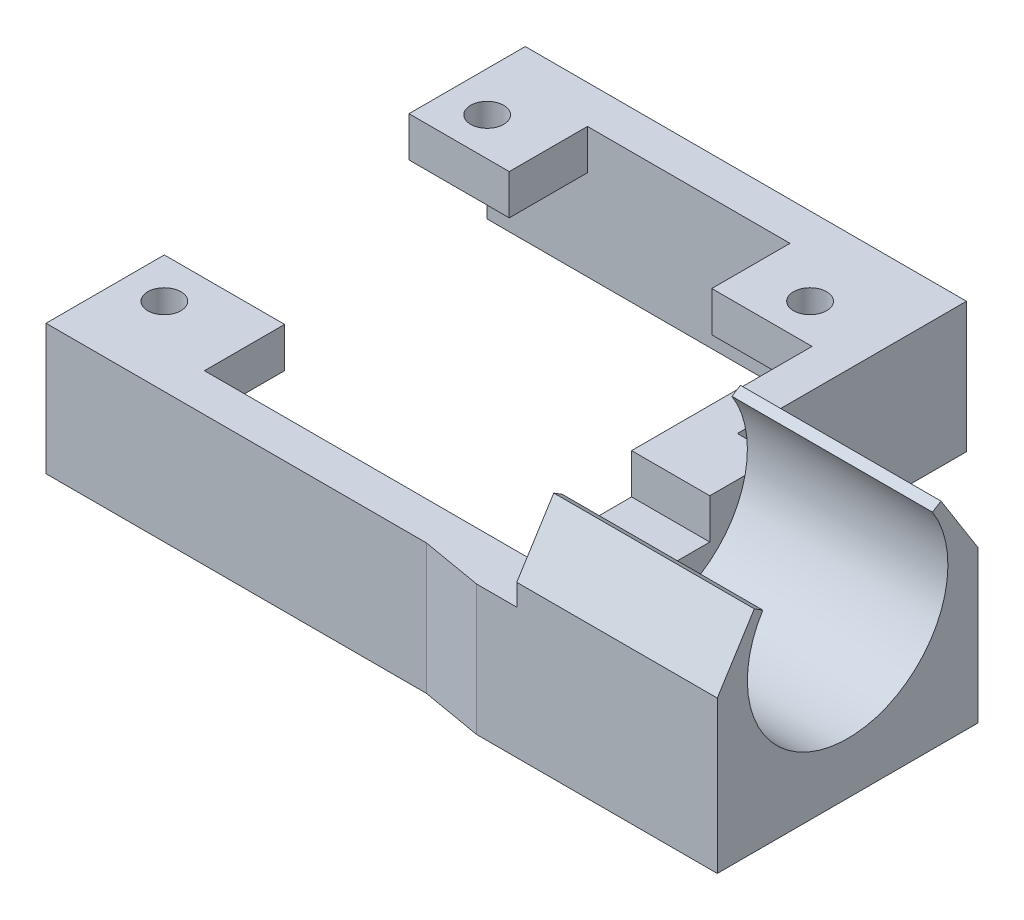
from build123d import *

# Parameters (mm, degrees)
BOSS_EXTRUDE1_DEPTH = 9
SKETCH11_W          = 26
SKETCH11_H          = 9
BOSS_EXTRUDE2_DEPTH = 4
BOSS_EXTRUDE3_START = 4
BOSS_EXTRUDE3_DEPTH = 20
BOSS_EXTRUDE4_DEPTH = 9
SKETCH13_W          = 12
SKETCH13_H          = 8
SKETCH13_R          = 1.65
SKETCH13_H_2        = 3.8
SKETCH13_W_2        = 20.2
SKETCH13_W_3        = 4
SKETCH13_H_3        = 6.75
BOSS_EXTRUDE5_DEPTH = 4


with BuildPart() as part:
    # Sketch1 → Boss-Extrude1 (new body)
    with BuildSketch(Plane(origin=(0, 0, 0), x_dir=(1, 0, 0), z_dir=(0, 1, 0))):
        Polygon((-20.1, 20.1), (20.1, 20.1), (20.1, -20.1), (-20.1, -20.1), (-20.1, -23.9), (23.9, -23.9), (23.9, 23.9), (-20.1, 23.9), align=None)
    extrude(amount=BOSS_EXTRUDE1_DEPTH)

    # Sketch11 → Boss-Extrude2 (add)
    with BuildSketch(Plane(origin=(23.9, 0, 0), x_dir=(0, 0, -1), z_dir=(1, 0, 0))):
        with Locations((-11.95, 4.5)):
            Rectangle(SKETCH11_W, SKETCH11_H)
    extrude(amount=BOSS_EXTRUDE2_DEPTH)

    # Sketch10 → Boss-Extrude3 (add)
    with BuildSketch(Plane(origin=(23.9, 0, 0), x_dir=(0, 0, -1), z_dir=(1, 0, 0)).offset(BOSS_EXTRUDE3_START)):
        with BuildLine():
            Line((-21.257692308, 21.01232581), (-24.95, 15.15))
            Line((-24.95, 15.15), (-24.95, 0))
            Line((-24.95, 0), (1.05, 0))
            Line((1.05, 0), (1.05, 15.15))
            Line((1.05, 15.15), (-2.642307692, 21.01232581))
            Line((-2.642307692, 21.01232581), (-3.488461538, 20.4793871))
            ThreePointArc((-3.488461538, 20.4793871), (-11.95, 5.15), (-20.411538462, 20.4793871))
            Line((-20.411538462, 20.4793871), (-21.257692308, 21.01232581))
        make_face()
    extrude(amount=BOSS_EXTRUDE3_DEPTH)

    # Sketch12 → Boss-Extrude4 (add)
    with BuildSketch(Plane(origin=(0, 9, 0), x_dir=(1, 0, 0), z_dir=(0, 1, 0))):
        Polygon((23.9, -24.95), (17.829406445, -23.9), (23.9, -23.9), align=None)
    extrude(amount=-BOSS_EXTRUDE4_DEPTH)

    # Sketch13 → Boss-Extrude5 (add)
    # profile 1 of 9: a face of its own
    with BuildSketch(Plane(origin=(0, 9, 0), x_dir=(1, 0, 0), z_dir=(0, 1, 0))):
        with Locations((-14.1, -16.1)):
            Rectangle(SKETCH13_W, SKETCH13_H)
        with Locations(Location((-16.1, -16.1, 0), (0, 0, 270))):
            Circle(SKETCH13_R, mode=Mode.SUBTRACT)
    # profile 2 of 9: a face of its own
    with BuildSketch(Plane(origin=(0, 9, 0), x_dir=(1, 0, 0), z_dir=(0, 1, 0))):
        with Locations((-14.1, -22)):
            Rectangle(SKETCH13_W, SKETCH13_H_2)
    # profile 3 of 9: a face of its own
    with BuildSketch(Plane(origin=(0, 9, 0), x_dir=(1, 0, 0), z_dir=(0, 1, 0))):
        Polygon((27.9, -20.1), (-8.1, -20.1), (-8.1, -23.9), (17.829406445, -23.9), (27.9, -23.9), align=None)
    # profile 4 of 9: a face of its own
    with BuildSketch(Plane(origin=(0, 9, 0), x_dir=(1, 0, 0), z_dir=(0, 1, 0))):
        Polygon((27.9, -23.9), (17.829406445, -23.9), (23.9, -24.95), (27.9, -24.95), align=None)
    # profile 5 of 9: a face of its own
    with BuildSketch(Plane(origin=(0, 9, 0), x_dir=(1, 0, 0), z_dir=(0, 1, 0))):
        Polygon((23.9, 12.3), (23.9, 23.9), (10.1, 23.9), (10.1, 20.1), (10.1, 12.3), (20.1, 12.3), align=None)
        with Locations(Location((16.1, 16.1, 0), (0, 0, 270))):
            Circle(SKETCH13_R, mode=Mode.SUBTRACT)
    # profile 6 of 9: a face of its own
    with BuildSketch(Plane(origin=(0, 9, 0), x_dir=(1, 0, 0), z_dir=(0, 1, 0))):
        with Locations((0, 22)):
            Rectangle(SKETCH13_W_2, SKETCH13_H_2)
    # profile 7 of 9: a face of its own
    with BuildSketch(Plane(origin=(0, 9, 0), x_dir=(1, 0, 0), z_dir=(0, 1, 0))):
        Polygon((23.9, 1.05), (23.9, 12.3), (20.1, 12.3), (20.1, -5.7), (23.9, -5.7), align=None)
    # profile 8 of 9: a face of its own
    with BuildSketch(Plane(origin=(0, 9, 0), x_dir=(1, 0, 0), z_dir=(0, 1, 0))):
        Polygon((-10.1, 20.1), (-10.1, 23.9), (-20.1, 23.9), (-20.1, 12.3), (-10.1, 12.3), align=None)
        with Locations(Location((-16.1, 16.1, 0), (0, 0, 270))):
            Circle(SKETCH13_R, mode=Mode.SUBTRACT)
    # profile 9 of 9: a face of its own
    with BuildSketch(Plane(origin=(0, 9, 0), x_dir=(1, 0, 0), z_dir=(0, 1, 0))):
        with Locations((25.9, -2.325)):
            Rectangle(SKETCH13_W_3, SKETCH13_H_3)
    extrude(amount=BOSS_EXTRUDE5_DEPTH)


solid = part.part
